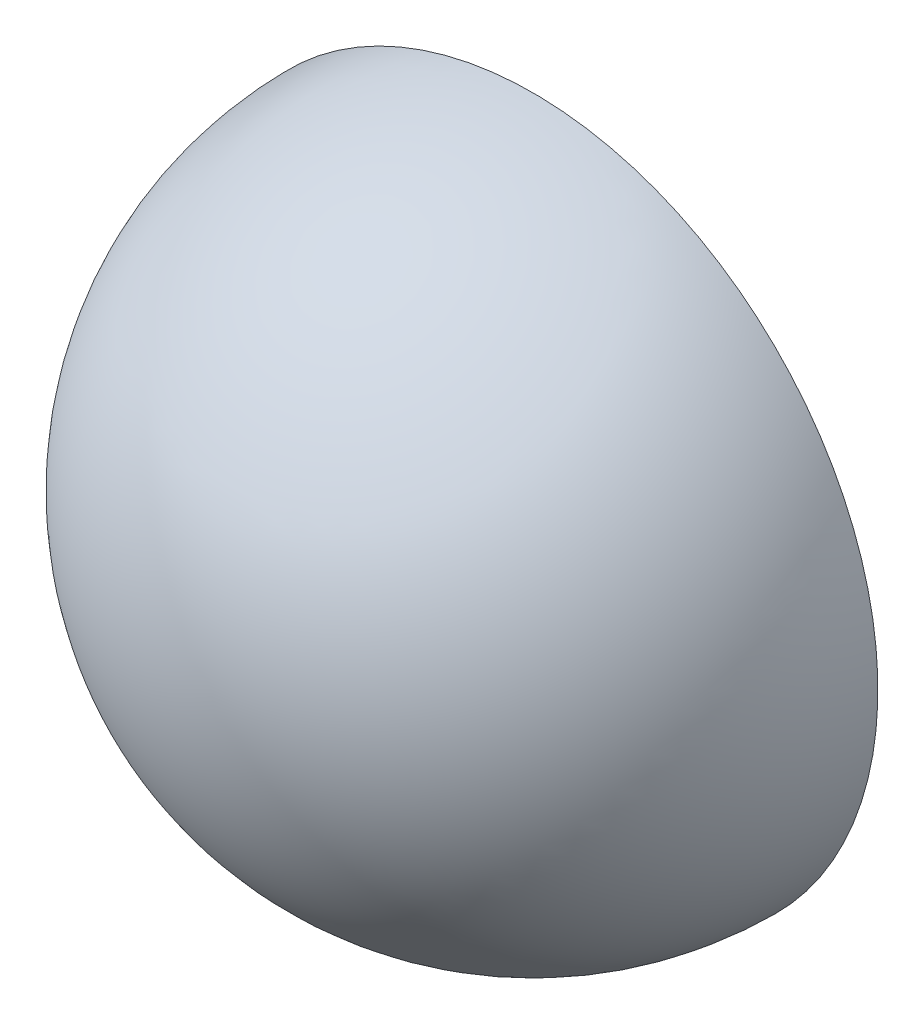
from build123d import *


with BuildPart() as part:
    # Эскиз1 → Повернуть1 (revolve)
    with BuildSketch(Plane(origin=(0, 0, 0), x_dir=(1, 0, 0), z_dir=(0, 1, 0))):
        with BuildLine():
            Line((0, 0), (0, -2))
            ThreePointArc((0, -2), (-1.414213562, -1.414213562), (-2, 0))
            Line((-2, 0), (0, 0))
        make_face()
    revolve(axis=Axis((0, 0, 0), (0, 0, 1)))


solid = part.part
